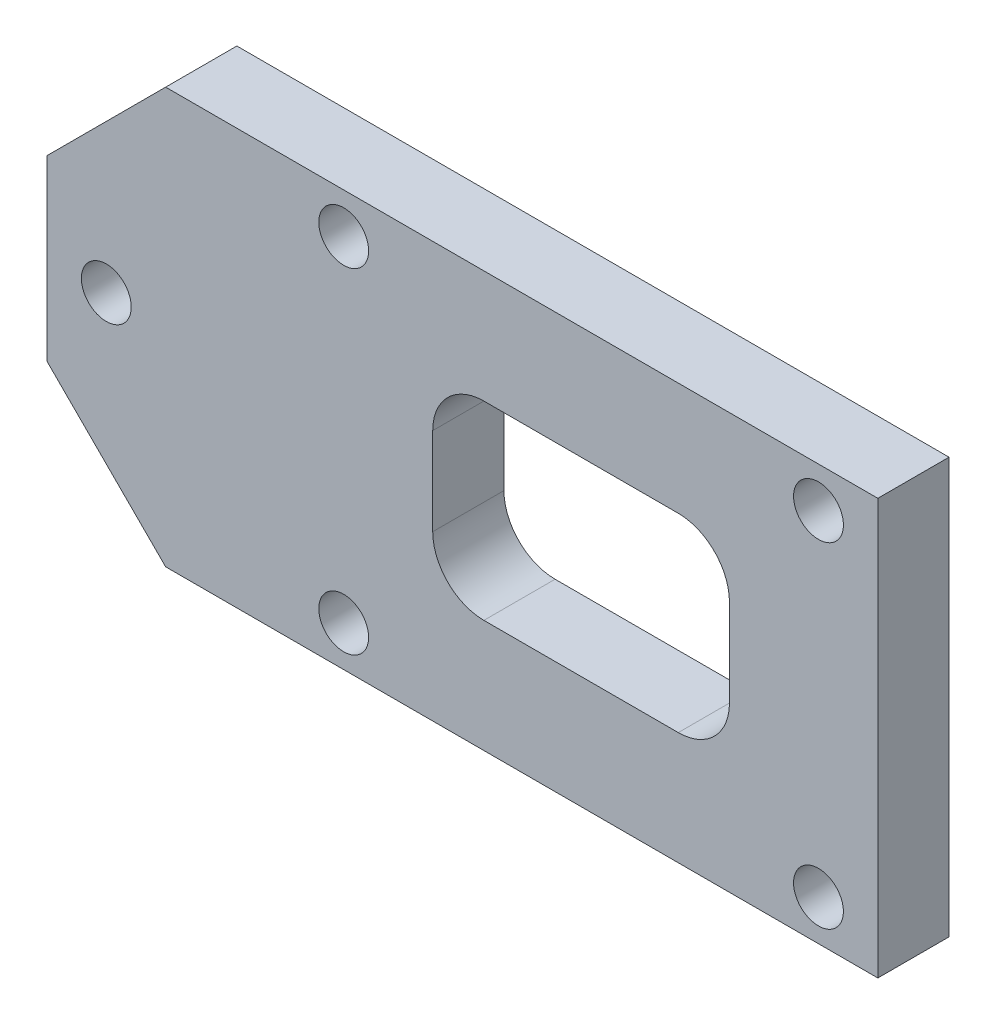
from build123d import *

# Parameters (mm, degrees)
SZKIC1_R                    = 2.1
DODANIE_WYCI_GNI_CIE1_DEPTH = 6


with BuildPart() as part:
    # Szkic1 → Dodanie-wyciągnięcie1 (new body)
    with BuildSketch(Plane.XY):
        Polygon((10, 0), (70, 0), (70, 35), (10, 35), (0, 25), (0, 10), align=None)
        with Locations((65, 31.6)):
            Circle(SZKIC1_R, mode=Mode.SUBTRACT)
        with Locations((25, 31.6)):
            Circle(SZKIC1_R, mode=Mode.SUBTRACT)
        with Locations(Location((65, 3.4, 0), (0, 0, 180))):
            Circle(SZKIC1_R, mode=Mode.SUBTRACT)
        with Locations(Location((25, 3.4, 0), (0, 0, 180))):
            Circle(SZKIC1_R, mode=Mode.SUBTRACT)
        with Locations((5, 17.5)):
            Circle(SZKIC1_R, mode=Mode.SUBTRACT)
        with BuildLine():
            Line((53.188946254, 9.5), (36.811053746, 9.5))
            ThreePointArc((36.811053746, 9.5), (33.762678408, 10.762678408), (32.5, 13.811053746))
            Line((32.5, 13.811053746), (32.5, 21.188946254))
            ThreePointArc((32.5, 21.188946254), (33.762678408, 24.237321592), (36.811053746, 25.5))
            Line((36.811053746, 25.5), (53.188946254, 25.5))
            ThreePointArc((53.188946254, 25.5), (56.237321592, 24.237321592), (57.5, 21.188946254))
            Line((57.5, 21.188946254), (57.5, 13.811053746))
            ThreePointArc((57.5, 13.811053746), (56.237321592, 10.762678408), (53.188946254, 9.5))
        make_face(mode=Mode.SUBTRACT)
    extrude(amount=DODANIE_WYCI_GNI_CIE1_DEPTH)


solid = part.part
